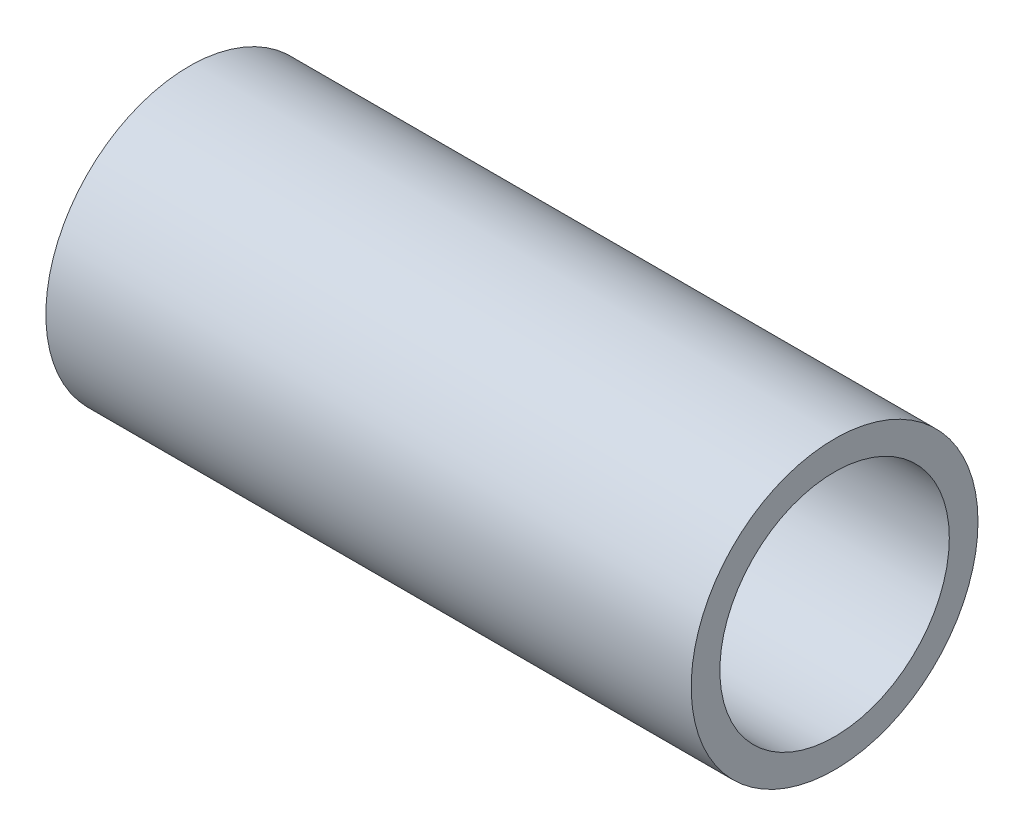
from build123d import *

# Parameters (mm, degrees)
SKETCH1_R           = 3.175
BOSS_EXTRUDE1_DEPTH = 14.2875
SKETCH6_R           = 2.54
CUT_EXTRUDE1_DEPTH  = 15.976445047


with BuildPart() as part:
    # Sketch1 → Boss-Extrude1 (new body)
    with BuildSketch(Plane(origin=(0, 0, 0), x_dir=(0, 0, -1), z_dir=(1, 0, 0))):
        Circle(SKETCH1_R)
    extrude(amount=BOSS_EXTRUDE1_DEPTH)

    # Sketch6 → Cut-Extrude1 (cut, through all)
    with BuildSketch(Plane(origin=(14.2875, 0, 0), x_dir=(0, 0, -1), z_dir=(1, 0, 0))):
        Circle(SKETCH6_R)
    extrude(amount=-CUT_EXTRUDE1_DEPTH, mode=Mode.SUBTRACT)


solid = part.part
